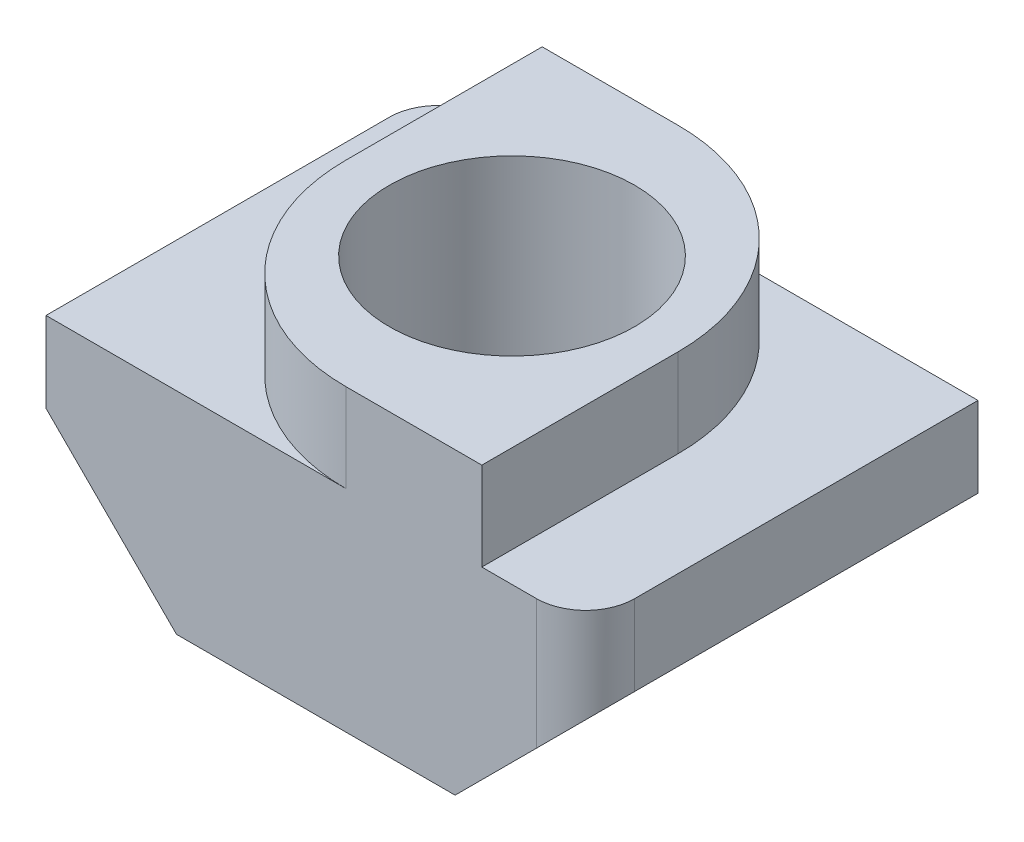
from build123d import *

# Parameters (mm, degrees)
SKETCH1_W           = 11
SKETCH1_H           = 8
SKETCH1_R           = 2.5
BOSS_EXTRUDE1_DEPTH = 4.3
CUT_EXTRUDE1_DEPTH  = 11.617909399
SKETCH3_W           = 6.77
SKETCH3_H           = 8
SKETCH3_R           = 2.5
BOSS_EXTRUDE2_DEPTH = 1.8
FILLET1_R           = 4
FILLET2_R           = 1


with BuildPart() as part:
    # Sketch1 → Boss-Extrude1 (new body)
    with BuildSketch(Plane(origin=(0, 0, 0), x_dir=(1, 0, 0), z_dir=(0, 1, 0))):
        Rectangle(SKETCH1_W, SKETCH1_H)
        with Locations(Location((0, 0, 0), (0, 0, 90))):
            Circle(SKETCH1_R, mode=Mode.SUBTRACT)
    extrude(amount=BOSS_EXTRUDE1_DEPTH)

    # Sketch2 → Cut-Extrude1 (cut, through all)
    with BuildSketch(Plane.XY.offset(4)):
        Polygon((-5.5, 2.66), (-2.84, 0), (-5.5, 0), align=None)
        Polygon((5.5, 2.66), (5.5, 0), (2.84, 0), align=None)
    extrude(amount=-CUT_EXTRUDE1_DEPTH, mode=Mode.SUBTRACT)

    # Sketch3 → Boss-Extrude2 (add)
    with BuildSketch(Plane(origin=(0, 4.3, 0), x_dir=(1, 0, 0), z_dir=(0, 1, 0))):
        Rectangle(SKETCH3_W, SKETCH3_H)
        with Locations(Location((0, 0, 0), (0, 0, 90))):
            Circle(SKETCH3_R, mode=Mode.SUBTRACT)
    extrude(amount=BOSS_EXTRUDE2_DEPTH)

    # Fillet1
    fillet1_edges = [part.edges().sort_by_distance(p)[0] for p in [
        (3.385, 5.2, -4),
        (-3.385, 5.2, 4),
    ]]
    fillet(fillet1_edges, radius=FILLET1_R)

    # Fillet2
    fillet2_edges = [part.edges().sort_by_distance(p)[0] for p in [
        (5.5, 3.48, 4),
        (-5.5, 3.48, -4),
    ]]
    fillet(fillet2_edges, radius=FILLET2_R)


solid = part.part
